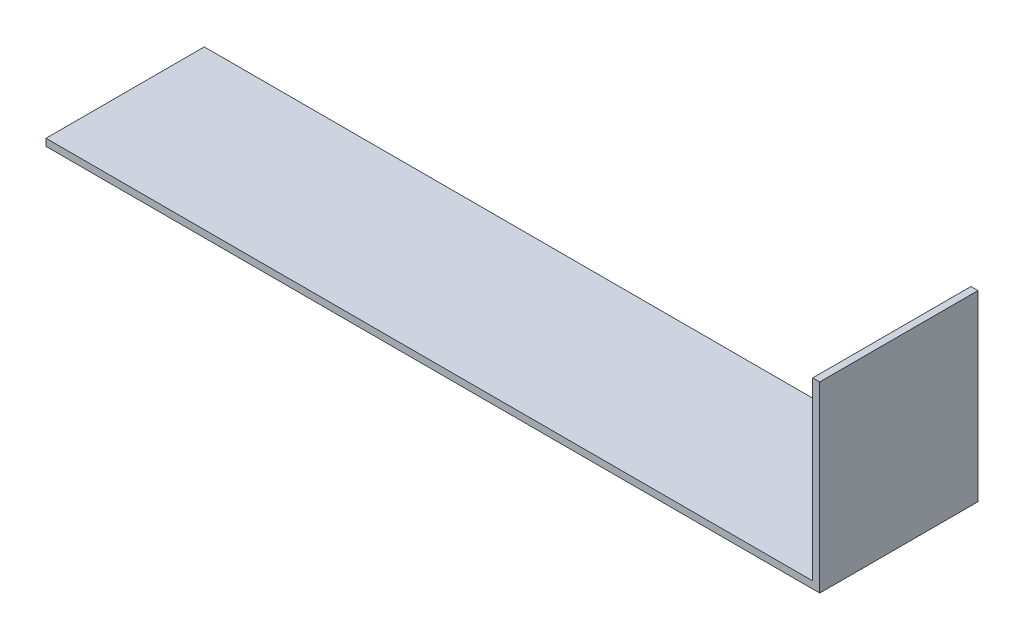
from build123d import *

# Parameters (mm, degrees)
SKETCH_1_W      = 220
SKETCH_1_H      = 45
EXTRUDE_1_DEPTH = 2
SKETCH_2_W      = 2
SKETCH_2_H      = 45
EXTRUDE_2_DEPTH = 50


with BuildPart() as part:
    # 草图1 → 凸台-拉伸1 (new body)
    with BuildSketch(Plane(origin=(0, 0, 0), x_dir=(1, 0, 0), z_dir=(0, 1, 0))):
        Rectangle(SKETCH_1_W, SKETCH_1_H)
    extrude(amount=EXTRUDE_1_DEPTH)

    # 草图2 → 凸台-拉伸2 (add)
    with BuildSketch(Plane(origin=(0, 2, 0), x_dir=(1, 0, 0), z_dir=(0, 1, 0))):
        with Locations((109, 0)):
            Rectangle(SKETCH_2_W, SKETCH_2_H)
    extrude(amount=EXTRUDE_2_DEPTH)


solid = part.part
